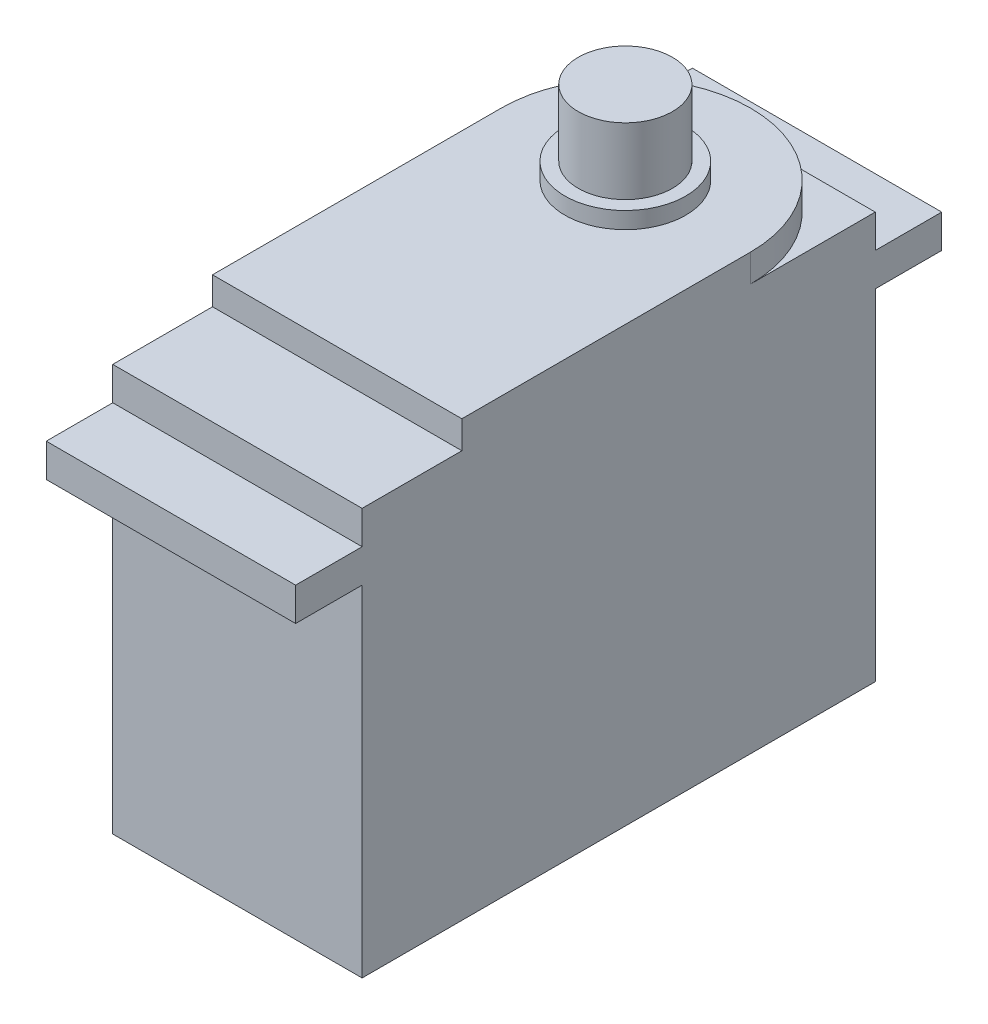
from build123d import *

# Parameters (mm, degrees)
SKETCH2_W           = 28.575
SKETCH2_H           = 58.801
BOSS_EXTRUDE1_DEPTH = 46.609
BOSS_EXTRUDE2_START = -3.81
SKETCH3_W           = 28.575
SKETCH3_H           = 74.041
BOSS_EXTRUDE2_DEPTH = 3.81
BOSS_EXTRUDE3_DEPTH = 3.175
SKETCH5_R           = 6.9215
BOSS_EXTRUDE4_DEPTH = 1.905
SKETCH6_R           = 5.3975
BOSS_EXTRUDE5_DEPTH = 7.62


with BuildPart() as part:
    # Sketch2 → Boss-Extrude1 (new body)
    with BuildSketch(Plane(origin=(0, 0, 0), x_dir=(1, 0, 0), z_dir=(0, 1, 0))):
        Rectangle(SKETCH2_W, SKETCH2_H)
    extrude(amount=BOSS_EXTRUDE1_DEPTH)

    # Sketch3 → Boss-Extrude2 (add)
    with BuildSketch(Plane(origin=(0, 46.609, 0), x_dir=(1, 0, 0), z_dir=(0, 1, 0)).offset(BOSS_EXTRUDE2_START)):
        Rectangle(SKETCH3_W, SKETCH3_H)
    extrude(amount=-BOSS_EXTRUDE2_DEPTH)

    # Sketch4 → Boss-Extrude3 (add)
    with BuildSketch(Plane(origin=(0, 46.609, 0), x_dir=(1, 0, 0), z_dir=(0, 1, 0))):
        with BuildLine():
            Line((-14.2875, 15.113), (-14.2875, -17.9705))
            Line((-14.2875, -17.9705), (14.2875, -17.9705))
            Line((14.2875, -17.9705), (14.2875, 15.113))
            ThreePointArc((14.2875, 15.113), (0, 29.4005), (-14.2875, 15.113))
        make_face()
    extrude(amount=BOSS_EXTRUDE3_DEPTH)

    # Sketch5 → Boss-Extrude4 (add)
    with BuildSketch(Plane(origin=(0, 49.784, 0), x_dir=(1, 0, 0), z_dir=(0, 1, 0))):
        with Locations(Location((0, 15.0495, 0), (0, 0, 90))):
            Circle(SKETCH5_R)
    extrude(amount=BOSS_EXTRUDE4_DEPTH)

    # Sketch6 → Boss-Extrude5 (add)
    with BuildSketch(Plane(origin=(0, 51.689, 0), x_dir=(1, 0, 0), z_dir=(0, 1, 0))):
        with Locations(Location((0, 15.0495, 0), (0, 0, 90))):
            Circle(SKETCH6_R)
    extrude(amount=BOSS_EXTRUDE5_DEPTH)


solid = part.part
